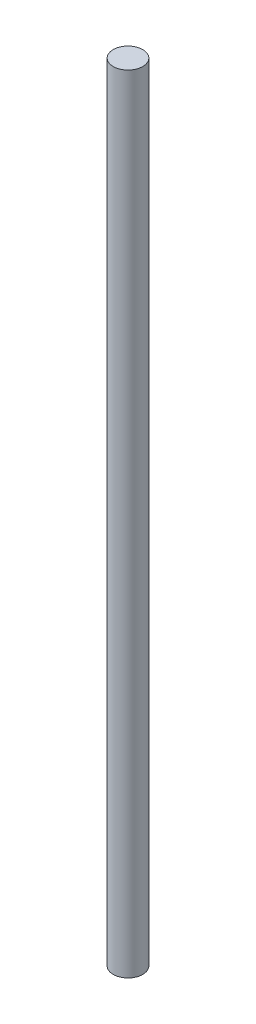
from build123d import *

# Parameters (mm, degrees)
SKETCH1_R           = 37.5
BOSS_EXTRUDE1_DEPTH = 2000


with BuildPart() as part:
    # Sketch1 → Boss-Extrude1 (new body)
    with BuildSketch(Plane(origin=(0, 0, 0), x_dir=(1, 0, 0), z_dir=(0, 1, 0))):
        with Locations(Location((0, 0, 0), (0, 0, 270))):
            Circle(SKETCH1_R)
    extrude(amount=BOSS_EXTRUDE1_DEPTH)


solid = part.part
